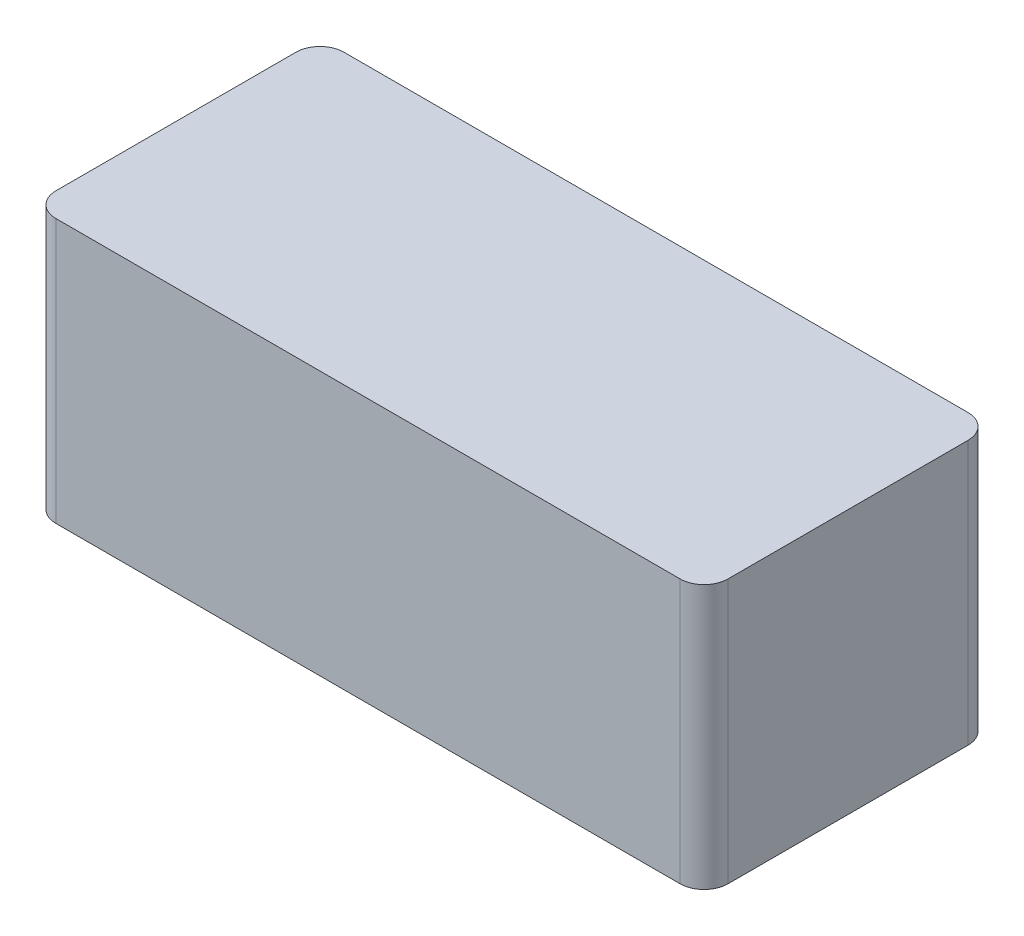
from build123d import *

# Parameters (mm, degrees)
SKETCH1_W           = 140
SKETCH1_H           = 60
BOSS_EXTRUDE1_DEPTH = 55
FILLET1_R           = 5


with BuildPart() as part:
    # Sketch1 → Boss-Extrude1 (new body)
    with BuildSketch(Plane(origin=(0, 0, 0), x_dir=(1, 0, 0), z_dir=(0, 1, 0))):
        Rectangle(SKETCH1_W, SKETCH1_H)
    extrude(amount=BOSS_EXTRUDE1_DEPTH)

    # Fillet1
    fillet1_edges = [part.edges().sort_by_distance(p)[0] for p in [
        (70, 27.5, 30),
        (-70, 27.5, 30),
        (-70, 27.5, -30),
        (70, 27.5, -30),
    ]]
    fillet(fillet1_edges, radius=FILLET1_R)


solid = part.part
